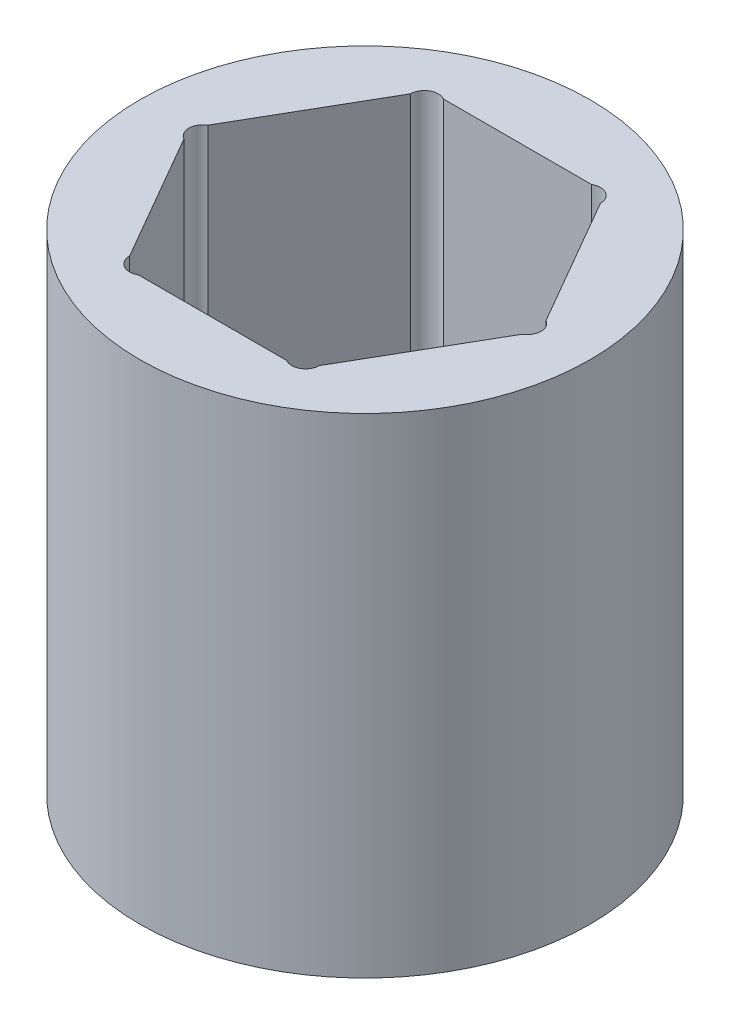
from build123d import *

# Parameters (mm, degrees)
SKETCH1_R           = 9.7536
BOSS_EXTRUDE1_DEPTH = 21.1836


with BuildPart() as part:
    # Sketch1 → Boss-Extrude1 (new body)
    with BuildSketch(Plane(origin=(0, 0, 0), x_dir=(1, 0, 0), z_dir=(0, 1, 0))):
        with Locations(Location((0, 0, 0), (0, 0, 270))):
            Circle(SKETCH1_R)
        with BuildLine():
            ThreePointArc((3.812821178, 6.604), (4.03243642, 6.384384758), (4.112821178, 6.084384758))
            Line((4.112821178, 6.084384758), (7.325642355, 0.519615242))
            ThreePointArc((7.325642355, 0.519615242), (7.545257598, 0.3), (7.625642355, 0))
            ThreePointArc((7.625642355, 0), (7.545257598, -0.3), (7.325642355, -0.519615242))
            Line((7.325642355, -0.519615242), (4.112821178, -6.084384758))
            ThreePointArc((4.112821178, -6.084384758), (4.03243642, -6.384384758), (3.812821178, -6.604))
            ThreePointArc((3.812821178, -6.604), (3.512821178, -6.684384758), (3.212821178, -6.604))
            Line((3.212821178, -6.604), (-3.212821178, -6.604))
            ThreePointArc((-3.212821178, -6.604), (-3.512821178, -6.684384758), (-3.812821178, -6.604))
            ThreePointArc((-3.812821178, -6.604), (-4.03243642, -6.384384758), (-4.112821178, -6.084384758))
            Line((-4.112821178, -6.084384758), (-7.325642355, -0.519615242))
            ThreePointArc((-7.325642355, -0.519615242), (-7.545257598, -0.3), (-7.625642355, 0))
            ThreePointArc((-7.625642355, 0), (-7.545257598, 0.3), (-7.325642355, 0.519615242))
            Line((-7.325642355, 0.519615242), (-4.112821178, 6.084384758))
            ThreePointArc((-4.112821178, 6.084384758), (-4.03243642, 6.384384758), (-3.812821178, 6.604))
            ThreePointArc((-3.812821178, 6.604), (-3.512821178, 6.684384758), (-3.212821178, 6.604))
            Line((-3.212821178, 6.604), (3.212821178, 6.604))
            ThreePointArc((3.212821178, 6.604), (3.512821178, 6.684384758), (3.812821178, 6.604))
        make_face(mode=Mode.SUBTRACT)
    extrude(amount=BOSS_EXTRUDE1_DEPTH)


solid = part.part
